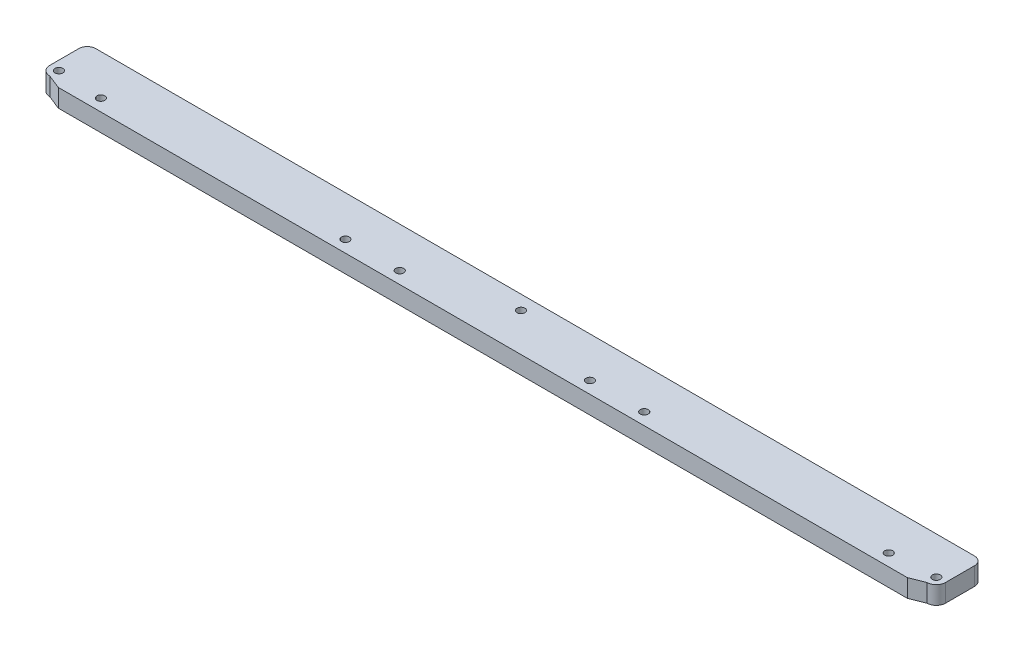
from build123d import *

# Parameters (mm, degrees)
SKETCH1_R           = 1.4
BOSS_EXTRUDE1_DEPTH = 6.35
FILLET1_R           = 3
SKETCH2_R           = 1.4
CUT_EXTRUDE1_DEPTH  = 159.930637386


with BuildPart() as part:
    # Sketch1 → Boss-Extrude1 (new body)
    with BuildSketch(Plane(origin=(0, 0, 0), x_dir=(1, 0, 0), z_dir=(0, 1, 0))):
        with BuildLine():
            Line((-158.25, 13.25), (-158.25, 0))
            ThreePointArc((-158.25, 0), (-157.298097039, -2.298097039), (-155, -3.25))
            Line((-155, -3.25), (-150, -5.25))
            Line((-150, -5.25), (150, -5.25))
            Line((150, -5.25), (155, -3.25))
            ThreePointArc((155, -3.25), (157.298097039, -2.298097039), (158.25, 0))
            Line((158.25, 0), (158.25, 13.25))
            Line((158.25, 13.25), (-158.25, 13.25))
        make_face()
        with Locations(Location((155, 0, 0), (0, 0, 270))):
            Circle(SKETCH1_R, mode=Mode.SUBTRACT)
        with Locations(Location((-155, 0, 0), (0, 0, 270))):
            Circle(SKETCH1_R, mode=Mode.SUBTRACT)
        with Locations(Location((0, 8.25, 0), (0, 0, 270))):
            Circle(SKETCH1_R, mode=Mode.SUBTRACT)
    extrude(amount=BOSS_EXTRUDE1_DEPTH)

    # Fillet1
    fillet1_edges = [part.edges().sort_by_distance(p)[0] for p in [
        (-158.25, 3.175, -13.25),
        (158.25, 3.175, -13.25),
    ]]
    fillet(fillet1_edges, radius=FILLET1_R)

    # Sketch2 → Cut-Extrude1 (cut, through all)
    with BuildSketch(Plane(origin=(0, 6.35, 0), x_dir=(1, 0, 0), z_dir=(0, 1, 0))):
        with Locations(Location((-33.6, -1, 0), (0, 0, 270))):
            Circle(SKETCH2_R)
        with Locations(Location((-52.8, -1, 0), (0, 0, 270))):
            Circle(SKETCH2_R)
        with Locations(Location((-139.2, -1, 0), (0, 0, 270))):
            Circle(SKETCH2_R)
        with Locations(Location((139.2, -1, 0), (0, 0, 90))):
            Circle(SKETCH2_R)
        with Locations(Location((52.8, -1, 0), (0, 0, 90))):
            Circle(SKETCH2_R)
        with Locations(Location((33.6, -1, 0), (0, 0, 90))):
            Circle(SKETCH2_R)
    extrude(amount=-CUT_EXTRUDE1_DEPTH, mode=Mode.SUBTRACT)


solid = part.part
